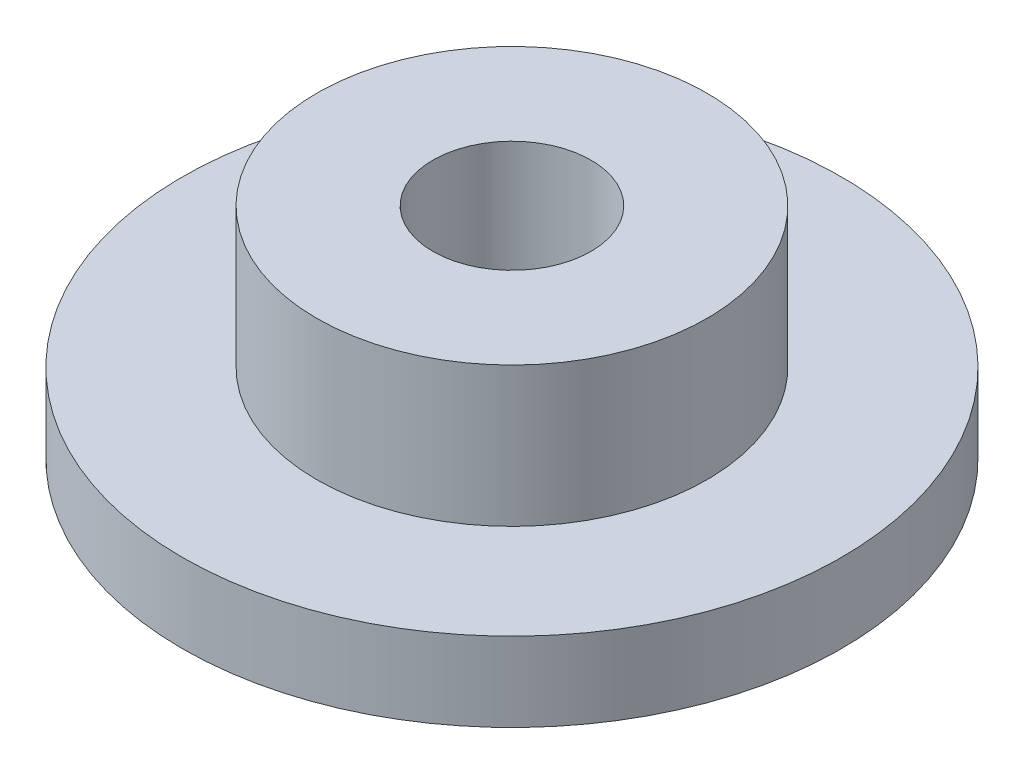
from build123d import *

# Parameters (mm, degrees)
SKETCH_1_R          = 12.5
EXTRUDE_1_DEPTH     = 3
SKETCH_2_R          = 7.4
EXTRUDE_2_DEPTH     = 5.3
CUT_EXTRUDE_1_REACH = 21.529
SKETCH_3_R          = 3


with BuildPart() as part:
    # 草图1 → 凸台-拉伸1 (new body)
    with BuildSketch(Plane(origin=(0, 0, 0), x_dir=(1, 0, 0), z_dir=(0, 1, 0))):
        with Locations(Location((0, 0, 0), (0, 0, 270))):
            Circle(SKETCH_1_R)
    extrude(amount=EXTRUDE_1_DEPTH)

    # 草图2 → 凸台-拉伸2 (add)
    with BuildSketch(Plane(origin=(0, 3, 0), x_dir=(1, 0, 0), z_dir=(0, 1, 0))):
        with Locations(Location((0, 0, 0), (0, 0, 270))):
            Circle(SKETCH_2_R)
    extrude(amount=EXTRUDE_2_DEPTH)

    # 草图3 → 切除-拉伸1 (cut, up to next)
    with BuildSketch(Plane(origin=(0, 8.3, 0), x_dir=(1, 0, 0), z_dir=(0, 1, 0)), mode=Mode.PRIVATE) as cut_extrude_1_sk1:
        with Locations(Location((0, 0, 0), (0, 0, 270))):
            Circle(SKETCH_3_R)
    cut_extrude_1_tool1 = extrude(cut_extrude_1_sk1.sketch, amount=-CUT_EXTRUDE_1_REACH, mode=Mode.PRIVATE) & part.part
    add(cut_extrude_1_tool1.solids().sort_by_distance((0, 8.3, 0))[0], mode=Mode.SUBTRACT)


solid = part.part
